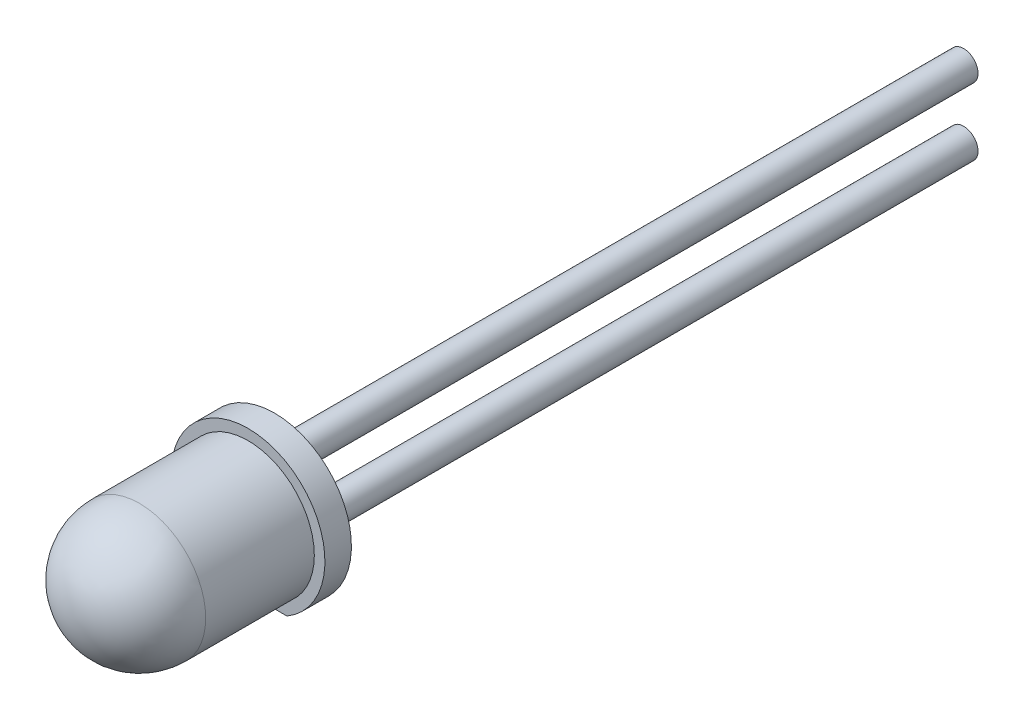
from build123d import *

# Parameters (mm, degrees)
SKETCH2_R           = 0.545
BOSS_EXTRUDE1_DEPTH = 26
SKETCH3_W           = 21.745407095
SKETCH3_H           = 16.160983483
CUT_EXTRUDE1_DEPTH  = 660
FILLET1_R           = 0.5


with BuildPart() as part:
    # Sketch1 → Revolve1 (revolve)
    with BuildSketch(Plane(origin=(0, 0, 0), x_dir=(0, 0, -1), z_dir=(1, 0, 0)), mode=Mode.PRIVATE) as revolve1_sk:
        with BuildLine():
            Line((6.6, 2.5), (2.5, 2.5))
            ThreePointArc((2.5, 2.5), (0.732233047, 1.767766953), (0, 0))
            Line((0, 0), (6.6, 0))
            Line((6.6, 0), (6.6, 2.5))
        make_face()
        Polygon((6.6, 2.9), (6.6, 2.5), (6.6, 0), (7.6, 0), (7.6, 2.780651434), (7.6, 2.9), align=None)
    revolve(revolve1_sk.sketch.rotate(Axis((0, 0, 0), (0, 0, -1)), 90), axis=Axis((0, 0, 0), (0, 0, -1)))

    # Sketch2 → Boss-Extrude1 (add)
    with BuildSketch(Plane(origin=(0, 0, -7.6), x_dir=(-1, 0, 0), z_dir=(0, 0, -1))):
        with Locations((0, 1.27)):
            Circle(SKETCH2_R)
        with Locations((0, -1.27)):
            Circle(SKETCH2_R)
    extrude(amount=BOSS_EXTRUDE1_DEPTH)

    # Sketch3 → Cut-Extrude1 (cut)
    with BuildSketch(Plane(origin=(0, -2.5, 0), x_dir=(-1, 0, 0), z_dir=(0, -1, 0))):
        with Locations((-4.780605062, 11.08865767)):
            Rectangle(SKETCH3_W, SKETCH3_H)
    extrude(amount=CUT_EXTRUDE1_DEPTH, mode=Mode.SUBTRACT)

    # Fillet1
    fillet1_edges = [part.edges().sort_by_distance(p)[0] for p in [
        (0.545, 1.27, -7.6),
        (0.545, -1.27, -7.6),
    ]]
    fillet(fillet1_edges, radius=FILLET1_R)


solid = part.part
